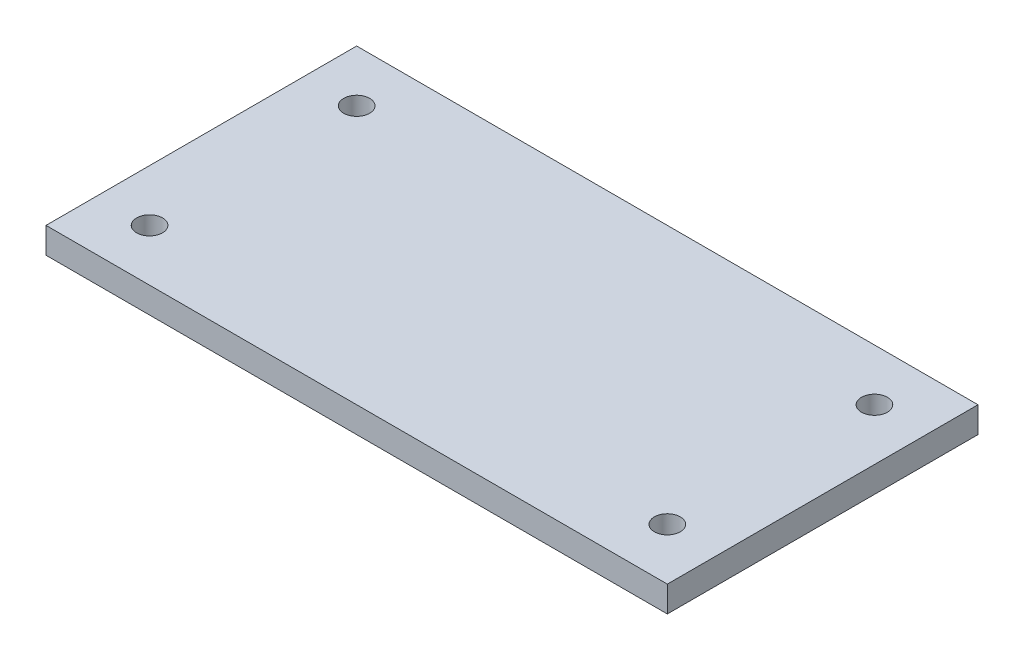
from build123d import *

# Parameters (mm, degrees)
SKETCH1_W           = 152.4
SKETCH1_H           = 76.2
SKETCH1_R           = 3.18262
BOSS_EXTRUDE1_DEPTH = 6.35


with BuildPart() as part:
    # Sketch1 → Boss-Extrude1 (new body)
    with BuildSketch(Plane(origin=(0, 0, 0), x_dir=(1, 0, 0), z_dir=(0, 1, 0))):
        Rectangle(SKETCH1_W, SKETCH1_H)
        with Locations(Location((-63.5, 25.4, 0), (0, 0, 270))):
            Circle(SKETCH1_R, mode=Mode.SUBTRACT)
        with Locations(Location((63.5, 25.4, 0), (0, 0, 270))):
            Circle(SKETCH1_R, mode=Mode.SUBTRACT)
        with Locations(Location((63.5, -25.4, 0), (0, 0, 270))):
            Circle(SKETCH1_R, mode=Mode.SUBTRACT)
        with Locations(Location((-63.5, -25.4, 0), (0, 0, 270))):
            Circle(SKETCH1_R, mode=Mode.SUBTRACT)
    extrude(amount=BOSS_EXTRUDE1_DEPTH)


solid = part.part
